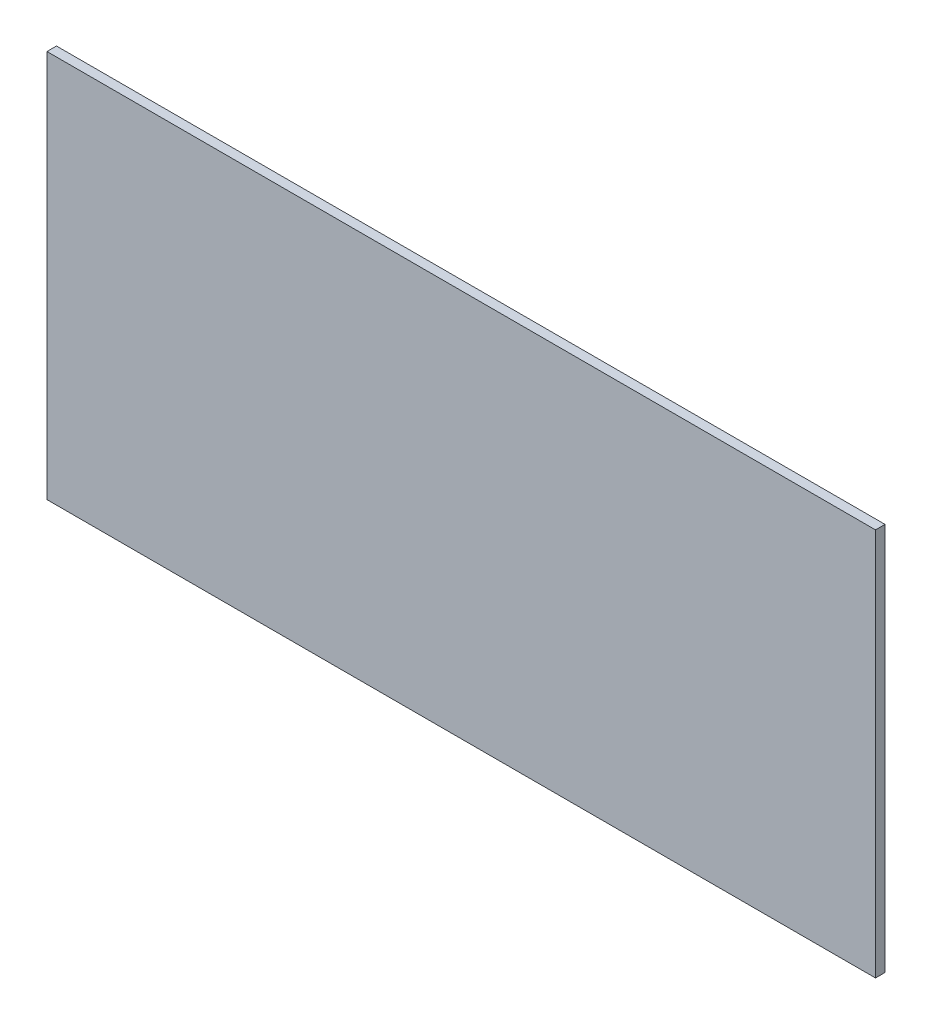
from build123d import *

# Parameters (mm, degrees)
ESQUISSE1_W        = 348
ESQUISSE1_H        = 163
BOSS_EXTRU_1_DEPTH = 4


with BuildPart() as part:
    # Esquisse1 → Boss.-Extru.1 (new body)
    with BuildSketch(Plane.XY):
        Rectangle(ESQUISSE1_W, ESQUISSE1_H)
    extrude(amount=BOSS_EXTRU_1_DEPTH)


solid = part.part
